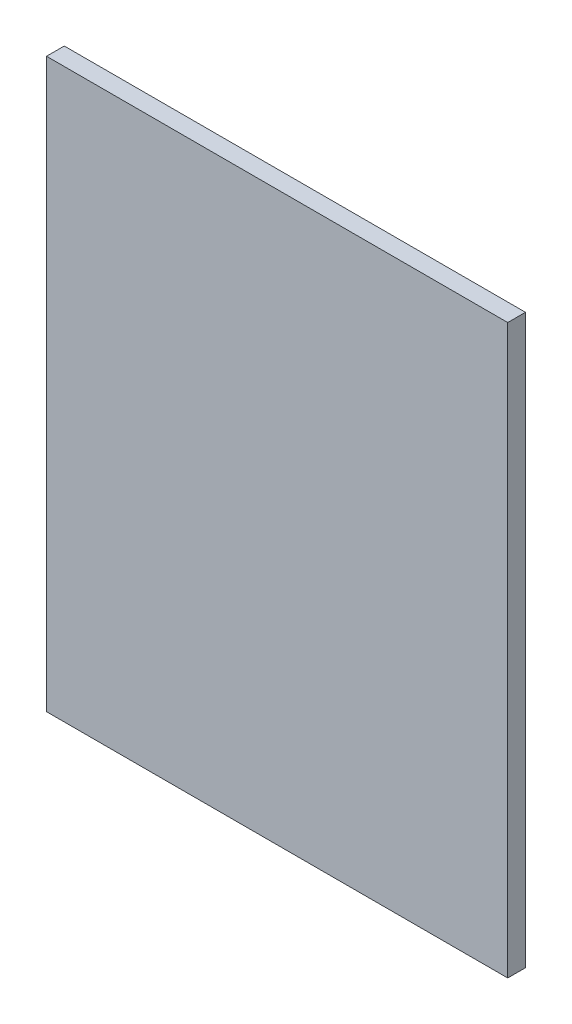
from build123d import *

# Parameters (mm, degrees)
SKETCH1_W           = 130
SKETCH1_H           = 160
BOSS_EXTRUDE1_DEPTH = 5


with BuildPart() as part:
    # Sketch1 → Boss-Extrude1 (new body)
    with BuildSketch(Plane.XY):
        with Locations((-65, 80)):
            Rectangle(SKETCH1_W, SKETCH1_H)
    extrude(amount=BOSS_EXTRUDE1_DEPTH)


solid = part.part
